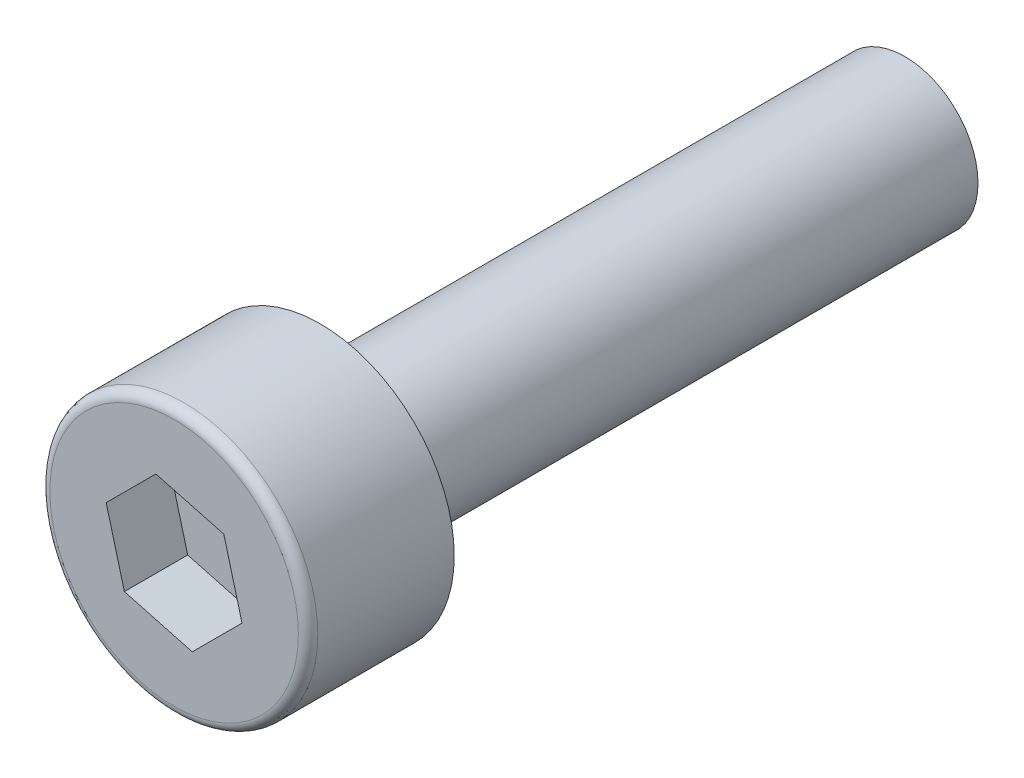
from build123d import *

# Parameters (mm, degrees)
SKETCH_1_R          = 2.75
EXTRUDE_1_DEPTH     = 3
CUT_EXTRUDE_1_DEPTH = 1.3
SKETCH_3_R          = 1.5
EXTRUDE_2_DEPTH     = 12
FILLET_1_R          = 0.2


with BuildPart() as part:
    # 草图1 → 凸台-拉伸1 (new body)
    with BuildSketch(Plane.XY):
        Circle(SKETCH_1_R)
    extrude(amount=EXTRUDE_1_DEPTH)

    # 草图2 → 切除-拉伸1 (cut)
    with BuildSketch(Plane.XY.offset(3)):
        Polygon((-1.020620726, -1.020620726), (0.373573113, -1.39419384), (1.39419384, -0.373573113), (1.020620726, 1.020620726), (-0.373573113, 1.39419384), (-1.39419384, 0.373573113), align=None)
    extrude(amount=-CUT_EXTRUDE_1_DEPTH, mode=Mode.SUBTRACT)

    # 草图3 → 凸台-拉伸2 (add)
    with BuildSketch(Plane(origin=(0, 0, 0), x_dir=(-1, 0, 0), z_dir=(0, 0, -1))):
        with Locations(Location((0, 0, 0), (0, 0, 180))):
            Circle(SKETCH_3_R)
    extrude(amount=EXTRUDE_2_DEPTH)

    # 圆角1
    fillet_1_edges = [part.edges().sort_by_distance(p)[0] for p in [
        (-2.75, 0, 3),
    ]]
    fillet(fillet_1_edges, radius=FILLET_1_R)


solid = part.part
